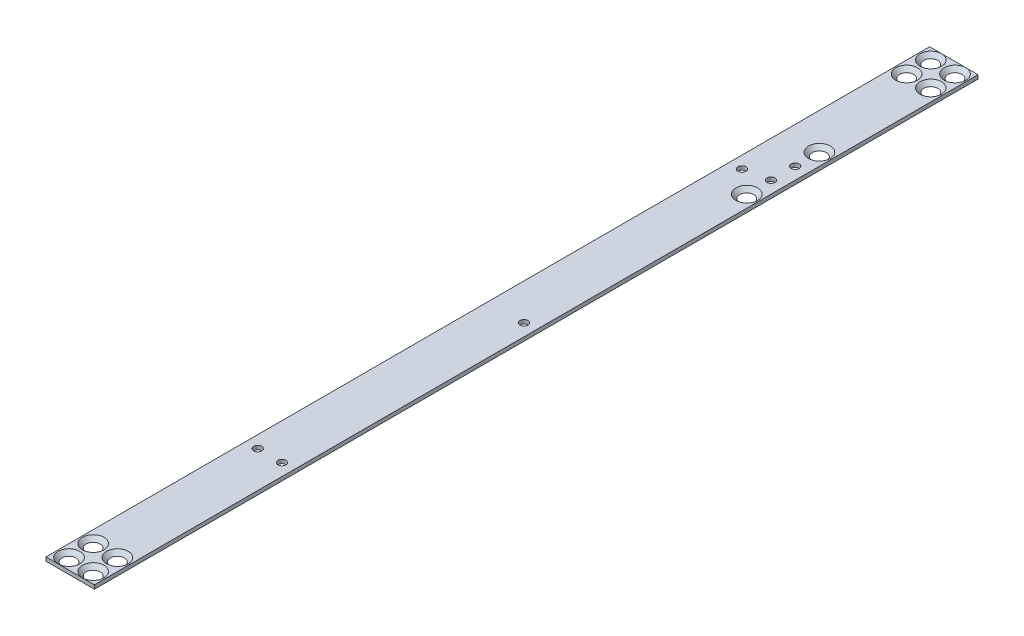
from build123d import *

# Parameters (mm, degrees)
SKETCH1_W                     = 20
SKETCH1_H                     = 365
BOSS_EXTRUDE1_DEPTH           = 1.5875
CSK_FOR_M4_SFHCS1_AT_2_COUNT  = 2
CSK_FOR_M4_SFHCS1_AT_2_PITCH  = 14.142135624
CSK_FOR_M4_SFHCS1_AT_3_COUNT  = 2
CSK_FOR_M4_SFHCS1_AT_3_PITCH  = 10
CSK_FOR_M4_SFHCS1_AT_4_COUNT  = 2
CSK_FOR_M4_SFHCS1_AT_4_PITCH  = 10
CSK_FOR_M4_SFHCS1_AT_5_COUNT  = 2
CSK_FOR_M4_SFHCS1_AT_5_PITCH  = 346
CSK_FOR_M4_SFHCS1_AT_6_COUNT  = 2
CSK_FOR_M4_SFHCS1_AT_6_PITCH  = 336.148776586
CSK_FOR_M4_SFHCS1_AT_7_COUNT  = 2
CSK_FOR_M4_SFHCS1_AT_7_PITCH  = 346.144478506
CSK_FOR_M4_SFHCS1_AT_8_COUNT  = 2
CSK_FOR_M4_SFHCS1_AT_8_PITCH  = 336
CSK_FOR_M4_SFHCS1_AT_9_COUNT  = 2
CSK_FOR_M4_SFHCS1_AT_9_PITCH  = 260
CSK_FOR_M4_SFHCS1_AT_10_COUNT = 2
CSK_FOR_M4_SFHCS1_AT_10_PITCH = 290
M4X0_7_TAPPED_HOLE1_D         = 3.3


with BuildPart() as part:
    # Sketch1 → Boss-Extrude1 (new body)
    with BuildSketch(Plane(origin=(0, 0, 0), x_dir=(1, 0, 0), z_dir=(0, 1, 0))):
        Rectangle(SKETCH1_W, SKETCH1_H)
    extrude(amount=BOSS_EXTRUDE1_DEPTH)

    # Sketch3 → CSK for M4 SFHCS1 (revolve, cut)
    with BuildSketch(Plane(origin=(5, 1.5875, 168), x_dir=(0, 0, 1), z_dir=(1, 0, 0))):
        Polygon((0, 0), (0, 1.5875), (2.25, 1.5875), (2.25, 2.23), (4.48, 0), align=None)
    csk_for_m4_sfhcs1 = revolve(axis=Axis((5, 7.9375, 168), (0, -1, 0)), mode=Mode.SUBTRACT)

    # CSK for M4 SFHCS1 at 2: CSK for M4 SFHCS1 ×2
    with Locations(*[Vector(-0.7071067811865469, 0, 0.7071067811865482) * (i * CSK_FOR_M4_SFHCS1_AT_2_PITCH) for i in range(1, CSK_FOR_M4_SFHCS1_AT_2_COUNT)]):
        add(csk_for_m4_sfhcs1, mode=Mode.SUBTRACT)

    # CSK for M4 SFHCS1 at 3: CSK for M4 SFHCS1 ×2
    with Locations(*[(-i * CSK_FOR_M4_SFHCS1_AT_3_PITCH, 0, 0) for i in range(1, CSK_FOR_M4_SFHCS1_AT_3_COUNT)]):
        add(csk_for_m4_sfhcs1, mode=Mode.SUBTRACT)

    # CSK for M4 SFHCS1 at 4: CSK for M4 SFHCS1 ×2
    with Locations(*[(0, 0, i * CSK_FOR_M4_SFHCS1_AT_4_PITCH) for i in range(1, CSK_FOR_M4_SFHCS1_AT_4_COUNT)]):
        add(csk_for_m4_sfhcs1, mode=Mode.SUBTRACT)

    # CSK for M4 SFHCS1 at 5: CSK for M4 SFHCS1 ×2
    with Locations(*[(0, 0, -i * CSK_FOR_M4_SFHCS1_AT_5_PITCH) for i in range(1, CSK_FOR_M4_SFHCS1_AT_5_COUNT)]):
        add(csk_for_m4_sfhcs1, mode=Mode.SUBTRACT)

    # CSK for M4 SFHCS1 at 6: CSK for M4 SFHCS1 ×2
    with Locations(*[Vector(-0.029748732396333223, 0, -0.9995574085167952) * (i * CSK_FOR_M4_SFHCS1_AT_6_PITCH) for i in range(1, CSK_FOR_M4_SFHCS1_AT_6_COUNT)]):
        add(csk_for_m4_sfhcs1, mode=Mode.SUBTRACT)

    # CSK for M4 SFHCS1 at 7: CSK for M4 SFHCS1 ×2
    with Locations(*[Vector(-0.028889670703889703, 0, -0.9995826063545828) * (i * CSK_FOR_M4_SFHCS1_AT_7_PITCH) for i in range(1, CSK_FOR_M4_SFHCS1_AT_7_COUNT)]):
        add(csk_for_m4_sfhcs1, mode=Mode.SUBTRACT)

    # CSK for M4 SFHCS1 at 8: CSK for M4 SFHCS1 ×2
    with Locations(*[(0, 0, -i * CSK_FOR_M4_SFHCS1_AT_8_PITCH) for i in range(1, CSK_FOR_M4_SFHCS1_AT_8_COUNT)]):
        add(csk_for_m4_sfhcs1, mode=Mode.SUBTRACT)

    # CSK for M4 SFHCS1 at 9: CSK for M4 SFHCS1 ×2
    with Locations(*[(0, 0, -i * CSK_FOR_M4_SFHCS1_AT_9_PITCH) for i in range(1, CSK_FOR_M4_SFHCS1_AT_9_COUNT)]):
        add(csk_for_m4_sfhcs1, mode=Mode.SUBTRACT)

    # CSK for M4 SFHCS1 at 10: CSK for M4 SFHCS1 ×2
    with Locations(*[(0, 0, -i * CSK_FOR_M4_SFHCS1_AT_10_PITCH) for i in range(1, CSK_FOR_M4_SFHCS1_AT_10_COUNT)]):
        add(csk_for_m4_sfhcs1, mode=Mode.SUBTRACT)

    # M4x0.7 Tapped Hole1 (through all)
    with Locations(Plane(origin=(0, 1.5875, 0), x_dir=(1, 0, 0), z_dir=(0, 1, 0))):
        with Locations((-5, -100), (-5, 100), (5, -100), (5, 0), (5, 102), (5, 112)):
            Hole(M4X0_7_TAPPED_HOLE1_D / 2)


solid = part.part
